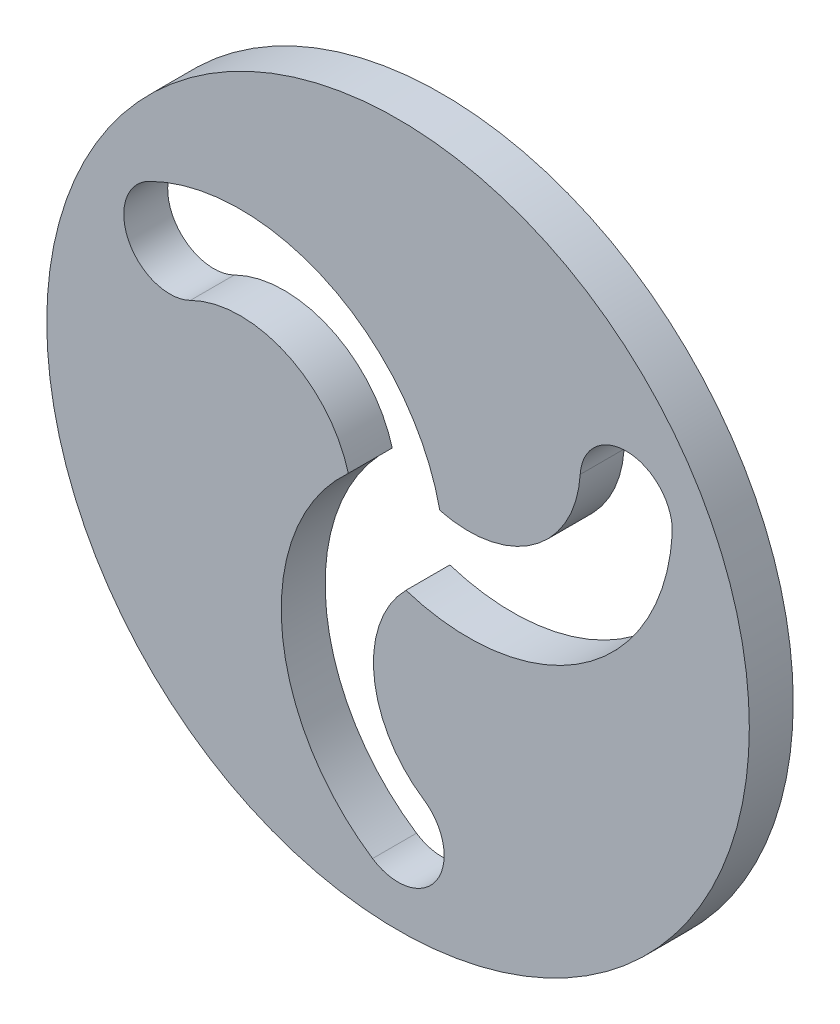
from build123d import *

# Parameters (mm, degrees)
CROQUIS1_R            = 40
DISCO_DEPTH           = 5
CORTAR_EXTRUIR1_DEPTH = 10


with BuildPart() as part:
    # Croquis1 → Disco (new body)
    with BuildSketch(Plane.XY):
        Circle(CROQUIS1_R)
    extrude(amount=DISCO_DEPTH)

    # Croquis6 → Cortar-Extruir1 (cut)
    with BuildSketch(Plane.XY.offset(5)):
        with BuildLine():
            ThreePointArc((20.740877626, 15.325746158), (15.478626449, 5.779368175), (4.761182136, 3.789140187))
            ThreePointArc((4.761182136, 3.789140187), (-7.887176724, 19.835329272), (-28.318599909, 19.700746158))
            ThreePointArc((-28.318599909, 19.700746158), (-30.681508271, 12.662162204), (-23.642924318, 10.299253842))
            ThreePointArc((-23.642924318, 10.299253842), (-12.744392882, 10.515199633), (-5.662082728, 2.228734589))
            ThreePointArc((-5.662082728, 2.228734589), (-13.23431068, -16.748160043), (-2.902046692, -34.375))
            ThreePointArc((-2.902046692, -34.375), (4.375, -32.902046692), (2.902046692, -25.625))
            ThreePointArc((2.902046692, -25.625), (-2.734233567, -16.294567808), (0.900900592, -6.017874775))
            ThreePointArc((0.900900592, -6.017874775), (21.121487404, -3.087169229), (31.220646601, 14.674253842))
            ThreePointArc((31.220646601, 14.674253842), (26.306508271, 20.239884487), (20.740877626, 15.325746158))
        make_face()
    extrude(amount=-CORTAR_EXTRUIR1_DEPTH, mode=Mode.SUBTRACT)


solid = part.part
